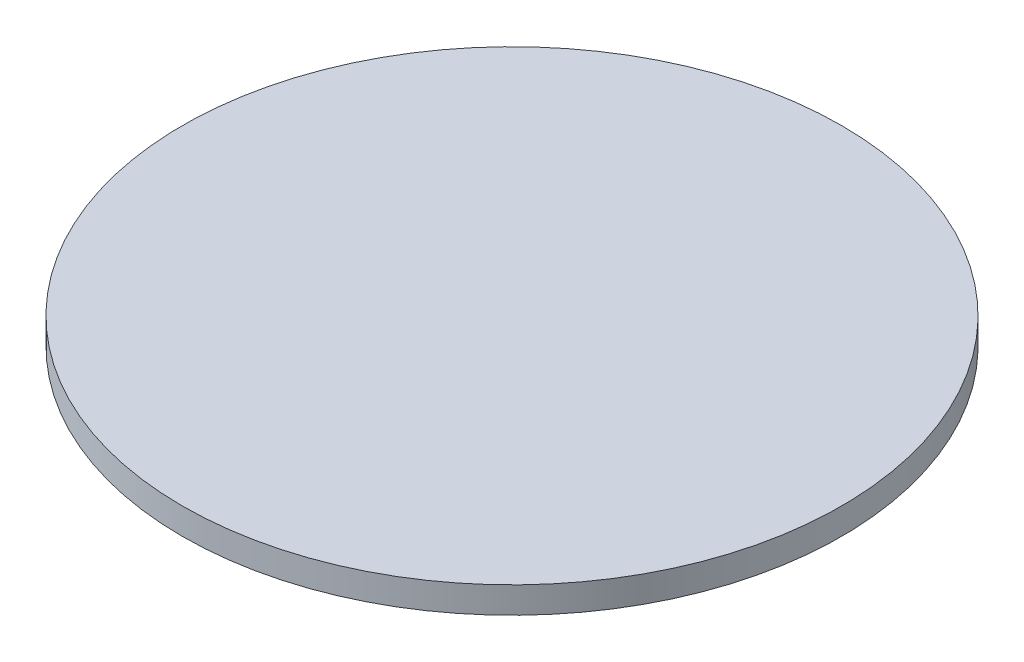
from build123d import *

# Parameters (mm, degrees)
SKETCH1_R           = 12.5
BOSS_EXTRUDE1_DEPTH = 1


with BuildPart() as part:
    # Sketch1 → Boss-Extrude1 (new body)
    with BuildSketch(Plane(origin=(0, 0, 0), x_dir=(1, 0, 0), z_dir=(0, 1, 0))):
        with Locations(Location((0, 0, 0), (0, 0, 270))):
            Circle(SKETCH1_R)
    extrude(amount=BOSS_EXTRUDE1_DEPTH)


solid = part.part
